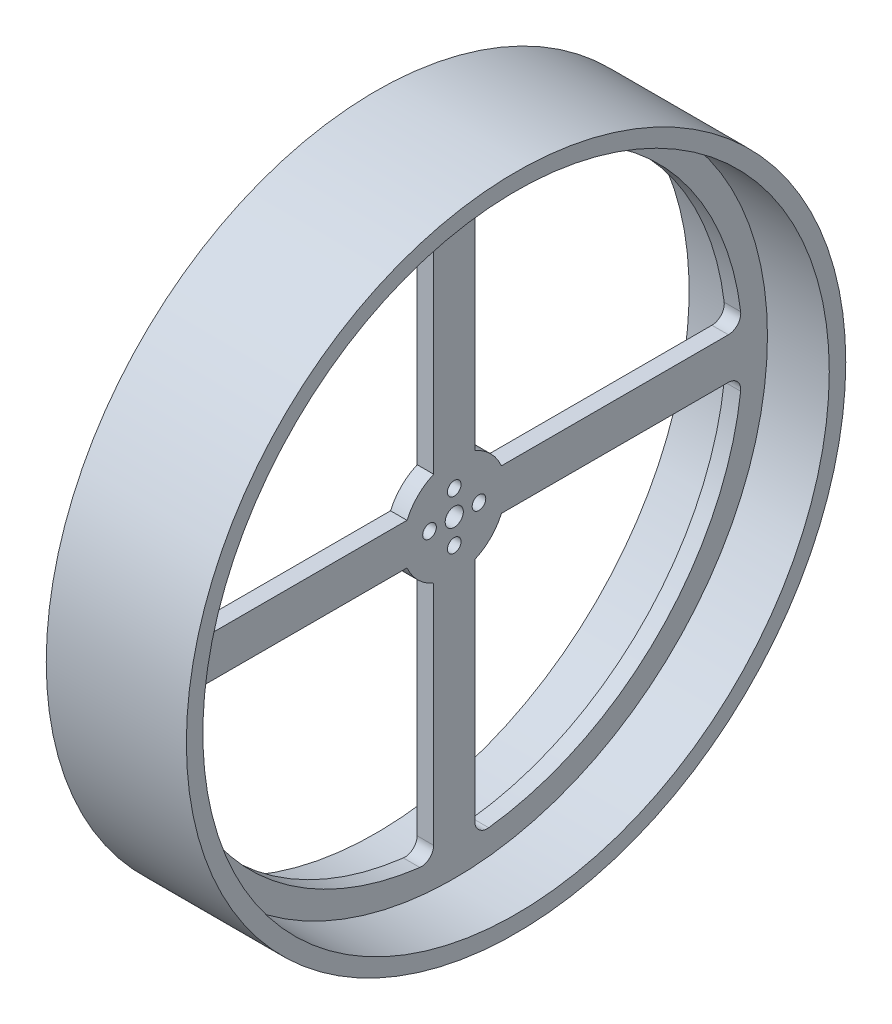
from build123d import *

# Parameters (mm, degrees)
SKETCH3_R           = 80
BOSS_EXTRUDE3_DEPTH = 4
SKETCH5_R           = 1.65
CUT_EXTRUDE3_DEPTH  = 114.207773585
CUT_EXTRUDE4_DEPTH  = 114.207773585
CIRPATTERN2_COUNT   = 4
FILLET2_R           = 3
BOSS_EXTRUDE4_START = 15
SKETCH7_R           = 80
SKETCH7_R_2         = 76
BOSS_EXTRUDE4_DEPTH = 15
SKETCH8_R           = 2.2
CUT_EXTRUDE5_DEPTH  = 115.721401665
SKETCH9_R           = 80
SKETCH9_R_2         = 76
BOSS_EXTRUDE5_DEPTH = 15


with BuildPart() as part:
    # Sketch3 → Boss-Extrude3 (new body)
    with BuildSketch(Plane.YZ):
        with Locations(Location((0, 0, 0), (0, 0, 270))):
            Circle(SKETCH3_R)
    extrude(amount=BOSS_EXTRUDE3_DEPTH)

    # Sketch5 → Cut-Extrude3 (cut, through all)
    with BuildSketch(Plane.YZ.offset(4)):
        with Locations(Location((0, 6, 0), (0, 0, 270))):
            Circle(SKETCH5_R)
        with Locations(Location((6, 0, 0), (0, 0, 270))):
            Circle(SKETCH5_R)
        with Locations(Location((0, -6, 0), (0, 0, 270))):
            Circle(SKETCH5_R)
        with Locations(Location((-6, 0, 0), (0, 0, 270))):
            Circle(SKETCH5_R)
    extrude(amount=-CUT_EXTRUDE3_DEPTH, mode=Mode.SUBTRACT)

    # Sketch6 → Cut-Extrude4 (cut, through all)
    with BuildSketch(Plane.YZ.offset(4)):
        with BuildLine():
            Line((11.456439237, 5), (69.821200219, 5))
            ThreePointArc((69.821200219, 5), (49.497474683, 49.497474683), (5, 69.821200219))
            Line((5, 69.821200219), (5, 11.456439237))
            ThreePointArc((5, 11.456439237), (8.838834765, 8.838834765), (11.456439237, 5))
        make_face()
    cut_extrude4 = extrude(amount=-CUT_EXTRUDE4_DEPTH, mode=Mode.SUBTRACT)

    # CirPattern2: Cut-Extrude4 ×4 about axis
    cirpattern2_axis = Axis((0, 0, 0), (1, 0, 0))
    for i in range(1, CIRPATTERN2_COUNT):
        add(cut_extrude4.rotate(cirpattern2_axis, i * 360 / CIRPATTERN2_COUNT), mode=Mode.SUBTRACT)

    # Fillet2
    fillet2_edges = [part.edges().sort_by_distance(p)[0] for p in [
        (2, 5, 69.821200219),
        (2, 69.821200219, 5),
        (2, 69.821200219, -5),
        (2, 5, -69.821200219),
        (2, -5, -69.821200219),
        (2, -69.821200219, -5),
        (2, -69.821200219, 5),
        (2, -5, 69.821200219),
    ]]
    fillet(fillet2_edges, radius=FILLET2_R)

    # Sketch7 → Boss-Extrude4 (add)
    with BuildSketch(Plane(origin=(0, 0, 0), x_dir=(0, -1, 0), z_dir=(-1, 0, 0)).offset(BOSS_EXTRUDE4_START)):
        with Locations(Location((0, 0, 0), (0, 0, 90))):
            Circle(SKETCH7_R)
        with Locations(Location((0, 0, 0), (0, 0, 90))):
            Circle(SKETCH7_R_2, mode=Mode.SUBTRACT)
    extrude(amount=-BOSS_EXTRUDE4_DEPTH)

    # Sketch8 → Cut-Extrude5 (cut, through all)
    with BuildSketch(Plane.YZ.offset(4)):
        with Locations(Location((0, 0, 0), (0, 0, 270))):
            Circle(SKETCH8_R)
    extrude(amount=-CUT_EXTRUDE5_DEPTH, mode=Mode.SUBTRACT)

    # Sketch9 → Boss-Extrude5 (add)
    with BuildSketch(Plane.YZ.offset(4)):
        with Locations(Location((0, 0, 0), (0, 0, 90))):
            Circle(SKETCH9_R)
        with Locations(Location((0, 0, 0), (0, 0, 90))):
            Circle(SKETCH9_R_2, mode=Mode.SUBTRACT)
    extrude(amount=BOSS_EXTRUDE5_DEPTH)


solid = part.part
